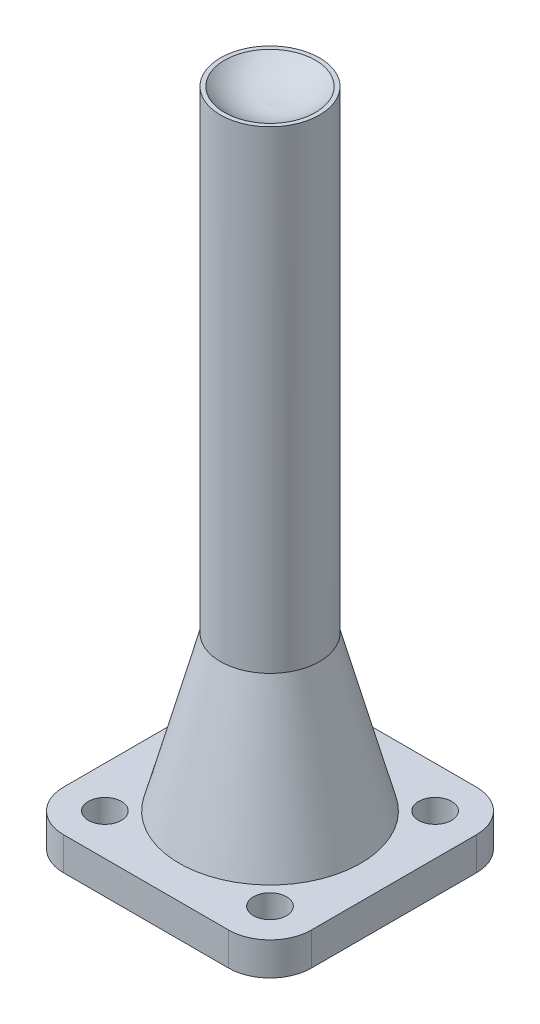
from build123d import *

# Parameters (mm, degrees)
SKETCH_1_W      = 30
SKETCH_1_H      = 30
SKETCH_1_R      = 2
EXTRUDE_1_DEPTH = 4
FILLET_1_R      = 5
SKETCH_2_R      = 6
EXTRUDE_2_DEPTH = 76
CHAMFER_1_SIZE  = 5
CHAMFER_1_SIZE2 = 18.660254038


with BuildPart() as part:
    # Эскиз1 → Бобышка-Вытянуть1 (new body)
    with BuildSketch(Plane(origin=(0, 0, 0), x_dir=(1, 0, 0), z_dir=(0, 1, 0))):
        Rectangle(SKETCH_1_W, SKETCH_1_H)
        with Locations(Location((-10, 10, 0), (0, 0, 270))):
            Circle(SKETCH_1_R, mode=Mode.SUBTRACT)
        with Locations(Location((10, 10, 0), (0, 0, 270))):
            Circle(SKETCH_1_R, mode=Mode.SUBTRACT)
        with Locations(Location((10, -10, 0), (0, 0, 270))):
            Circle(SKETCH_1_R, mode=Mode.SUBTRACT)
        with Locations(Location((-10, -10, 0), (0, 0, 270))):
            Circle(SKETCH_1_R, mode=Mode.SUBTRACT)
    extrude(amount=EXTRUDE_1_DEPTH)

    # Скругление1
    fillet_1_edges = [part.edges().sort_by_distance(p)[0] for p in [
        (15, 2, 15),
        (-15, 2, 15),
        (-15, 2, -15),
        (15, 2, -15),
    ]]
    fillet(fillet_1_edges, radius=FILLET_1_R)

    # Эскиз2 → Бобышка-Вытянуть2 (add)
    with BuildSketch(Plane(origin=(0, 4, 0), x_dir=(1, 0, 0), z_dir=(0, 1, 0))):
        with Locations(Location((0, 0, 0), (0, 0, 270))):
            Circle(SKETCH_2_R)
    extrude(amount=EXTRUDE_2_DEPTH)

    # Эскиз7 → Вырез-Повернуть3 (revolve, cut)
    with BuildSketch(Plane.XY):
        with BuildLine():
            Line((5.5, 80), (0, 80))
            Line((0, 80), (0, 78))
            ThreePointArc((0, 78), (2.979435889, 78.369051304), (5.5, 80))
        make_face()
    revolve(axis=Axis((0, 82.404747685, 0), (0, -1, 0)), mode=Mode.SUBTRACT)

    # Фаска1
    chamfer_1_edges = [part.edges().sort_by_distance(p)[0] for p in [
        (0, 4, -6),
    ]]
    chamfer_1_side = [part.faces().sort_by_distance(p)[0] for p in [
        (0, 4, 14.575735931),
    ]]
    chamfer(chamfer_1_edges, length=CHAMFER_1_SIZE, length2=CHAMFER_1_SIZE2, reference=chamfer_1_side[0])


solid = part.part
